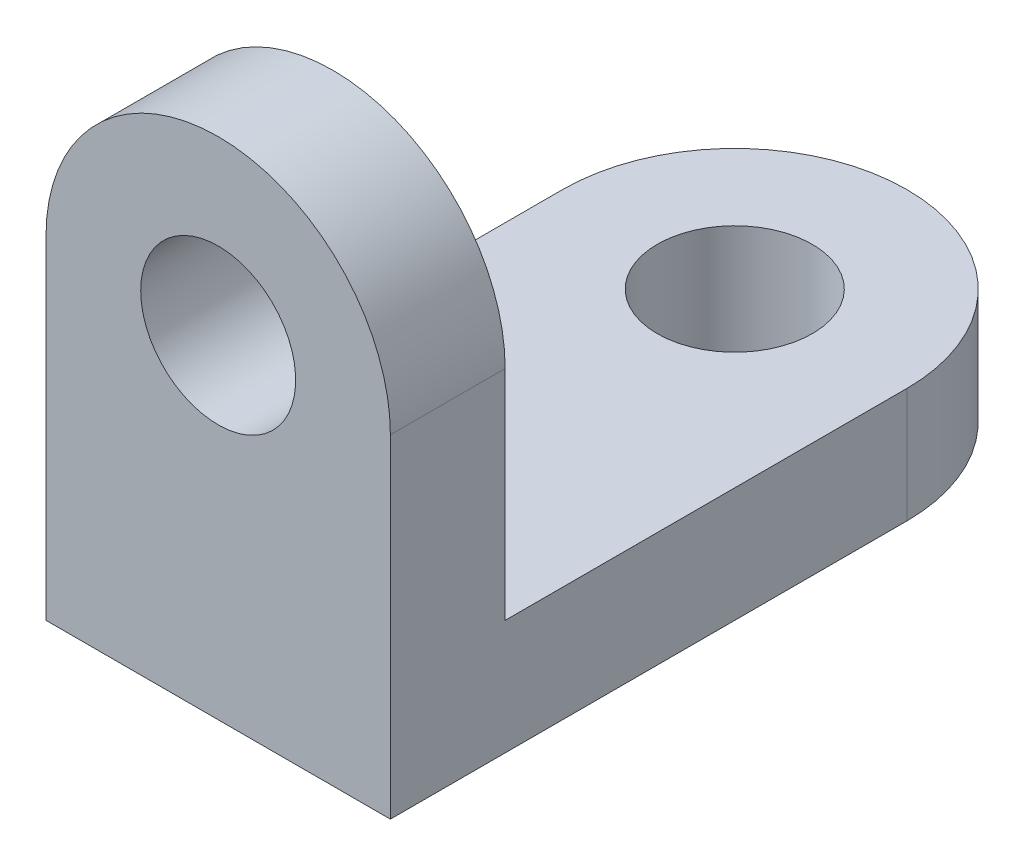
from build123d import *

# Parameters (mm, degrees)
ESQUISSE1_W             = 15
ESQUISSE1_H             = 30
BOSS_EXTRU_1_DEPTH      = 5
ESQUISSE2_W             = 15
ESQUISSE2_H             = 5
BOSS_EXTRU_2_DEPTH      = 17
CONG_1_RADIUS           = 7.5
CONG_1_LENGTH           = 5
CONG_3_RADIUS           = 7.5
CONG_3_LENGTH           = 5
ESQUISSE3_R             = 3.375
ENL_V_MAT_EXTRU_1_DEPTH = 10
ESQUISSE4_R             = 3.375
ENL_V_MAT_EXTRU_2_DEPTH = 10


with BuildPart() as part:
    # Esquisse1 → Boss.-Extru.1 (new body)
    with BuildSketch(Plane(origin=(0, 0, 0), x_dir=(1, 0, 0), z_dir=(0, 1, 0))):
        with Locations((0, 1.739690722)):
            Rectangle(ESQUISSE1_W, ESQUISSE1_H)
    extrude(amount=BOSS_EXTRU_1_DEPTH)

    # Esquisse2 → Boss.-Extru.2 (add)
    with BuildSketch(Plane(origin=(0, 5, 0), x_dir=(1, 0, 0), z_dir=(0, 1, 0))):
        with Locations((0, -10.760309278)):
            Rectangle(ESQUISSE2_W, ESQUISSE2_H)
    extrude(amount=BOSS_EXTRU_2_DEPTH)

    # Congé1: full round fillet: the end face becomes a half cylinder, R = half its width
    cong_1_face = Plane((0, 2.5, -16.739690722), x_dir=(0, 1, 0), z_dir=(0, 0, -1))  # on the end face: x along it, z out of the body
    cong_1_slab = cong_1_face.offset(-CONG_1_RADIUS / 2) * Box(CONG_1_LENGTH, 2 * CONG_1_RADIUS, CONG_1_RADIUS, mode=Mode.PRIVATE)  # the body's end, R deep
    cong_1_round = Plane((0, 2.5, -9.239690722), x_dir=(0, 0, -1), z_dir=(0, 1, 0)) * Cylinder(CONG_1_RADIUS, CONG_1_LENGTH, mode=Mode.PRIVATE)  # its axis R under the face
    add(cong_1_slab - cong_1_round, mode=Mode.SUBTRACT)

    # Congé3: full round fillet: the end face becomes a half cylinder, R = half its width
    cong_3_face = Plane((0, 22, 10.760309278), x_dir=(0, 0, -1), z_dir=(0, 1, 0))  # on the end face: x along it, z out of the body
    cong_3_slab = cong_3_face.offset(-CONG_3_RADIUS / 2) * Box(CONG_3_LENGTH, 2 * CONG_3_RADIUS, CONG_3_RADIUS, mode=Mode.PRIVATE)  # the body's end, R deep
    cong_3_round = Plane((0, 14.5, 10.760309278), x_dir=(0, 1, 0), z_dir=(0, 0, -1)) * Cylinder(CONG_3_RADIUS, CONG_3_LENGTH, mode=Mode.PRIVATE)  # its axis R under the face
    add(cong_3_slab - cong_3_round, mode=Mode.SUBTRACT)

    # Esquisse3 → Enlèv. mat.-Extru.1 (cut)
    with BuildSketch(Plane(origin=(0, 5, 0), x_dir=(1, 0, 0), z_dir=(0, 1, 0))):
        with Locations(Location((0, 9.239690722, 0), (0, 0, 270))):
            Circle(ESQUISSE3_R)
    extrude(amount=-ENL_V_MAT_EXTRU_1_DEPTH, mode=Mode.SUBTRACT)

    # Esquisse4 → Enlèv. mat.-Extru.2 (cut)
    with BuildSketch(Plane(origin=(0, 0, 8.260309278), x_dir=(-1, 0, 0), z_dir=(0, 0, -1))):
        with Locations((0, 14.5)):
            Circle(ESQUISSE4_R)
    extrude(amount=-ENL_V_MAT_EXTRU_2_DEPTH, mode=Mode.SUBTRACT)


solid = part.part
